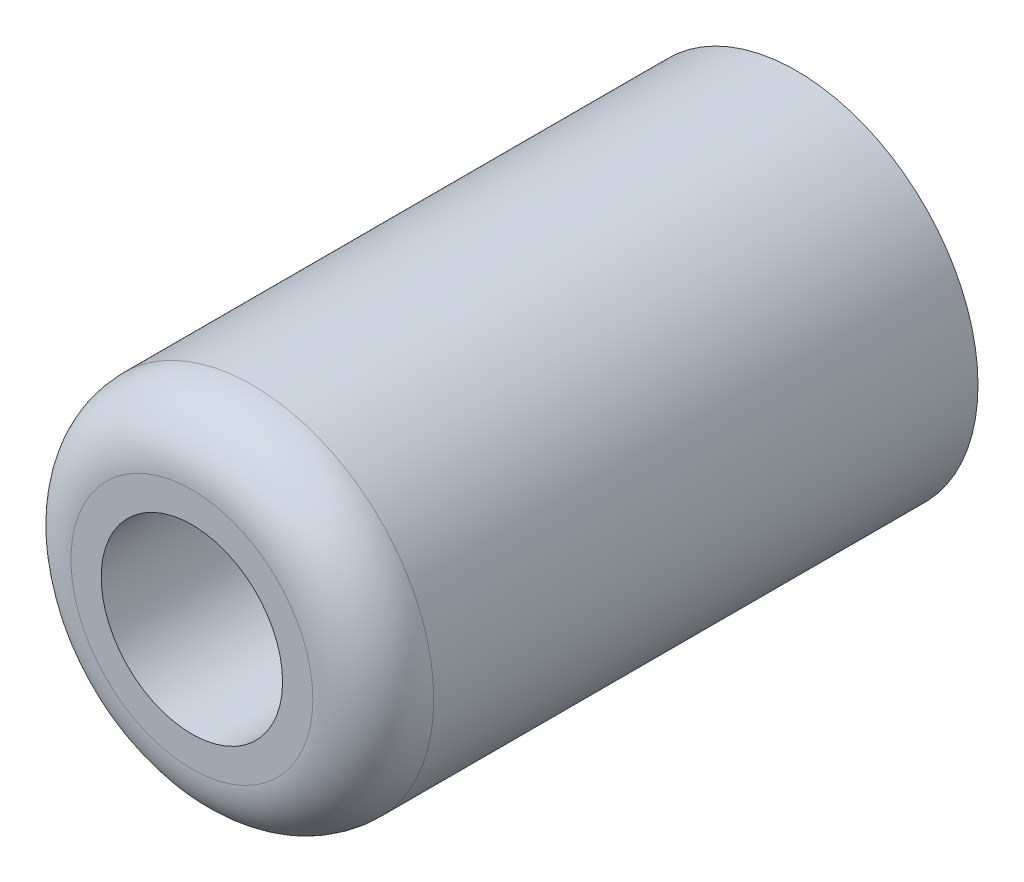
from build123d import *

# Parameters (mm, degrees)
ESQUISSE1_R        = 6
ESQUISSE1_R_2      = 3
BOSS_EXTRU_1_DEPTH = 20
CONG_1_R           = 2


with BuildPart() as part:
    # Esquisse1 → Boss.-Extru.1 (new body)
    with BuildSketch(Plane.XY):
        Circle(ESQUISSE1_R)
        Circle(ESQUISSE1_R_2, mode=Mode.SUBTRACT)
    extrude(amount=BOSS_EXTRU_1_DEPTH)

    # Congé1
    cong_1_edges = [part.edges().sort_by_distance(p)[0] for p in [
        (-6, 0, 20),
    ]]
    fillet(cong_1_edges, radius=CONG_1_R)


solid = part.part
